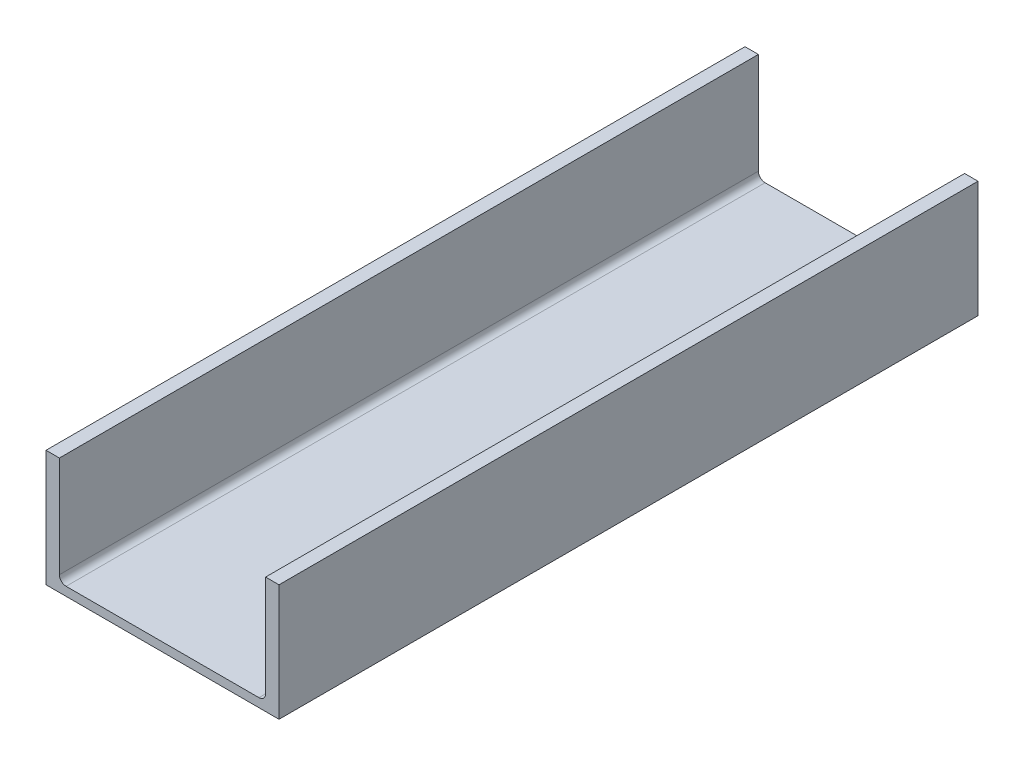
from build123d import *

# Parameters (mm, degrees)
BOSS_EXTRUDE1_DEPTH = 152.4
FILLET1_R           = 2.921


with BuildPart() as part:
    # Sketch3 → Boss-Extrude1 (new, symmetric)
    with BuildSketch(Plane.XY):
        Polygon((-50.8, 25.4), (-50.8, -25.4), (50.8, -25.4), (50.8, 25.4), (44.958, 25.4), (44.958, -21.59), (-44.958, -21.59), (-44.958, 25.4), align=None)
    extrude(amount=BOSS_EXTRUDE1_DEPTH, both=True)

    # Fillet1
    fillet1_edges = [part.edges().sort_by_distance(p)[0] for p in [
        (-44.958, -21.59, 0),
        (44.958, -21.59, 0),
    ]]
    fillet(fillet1_edges, radius=FILLET1_R)


solid = part.part
